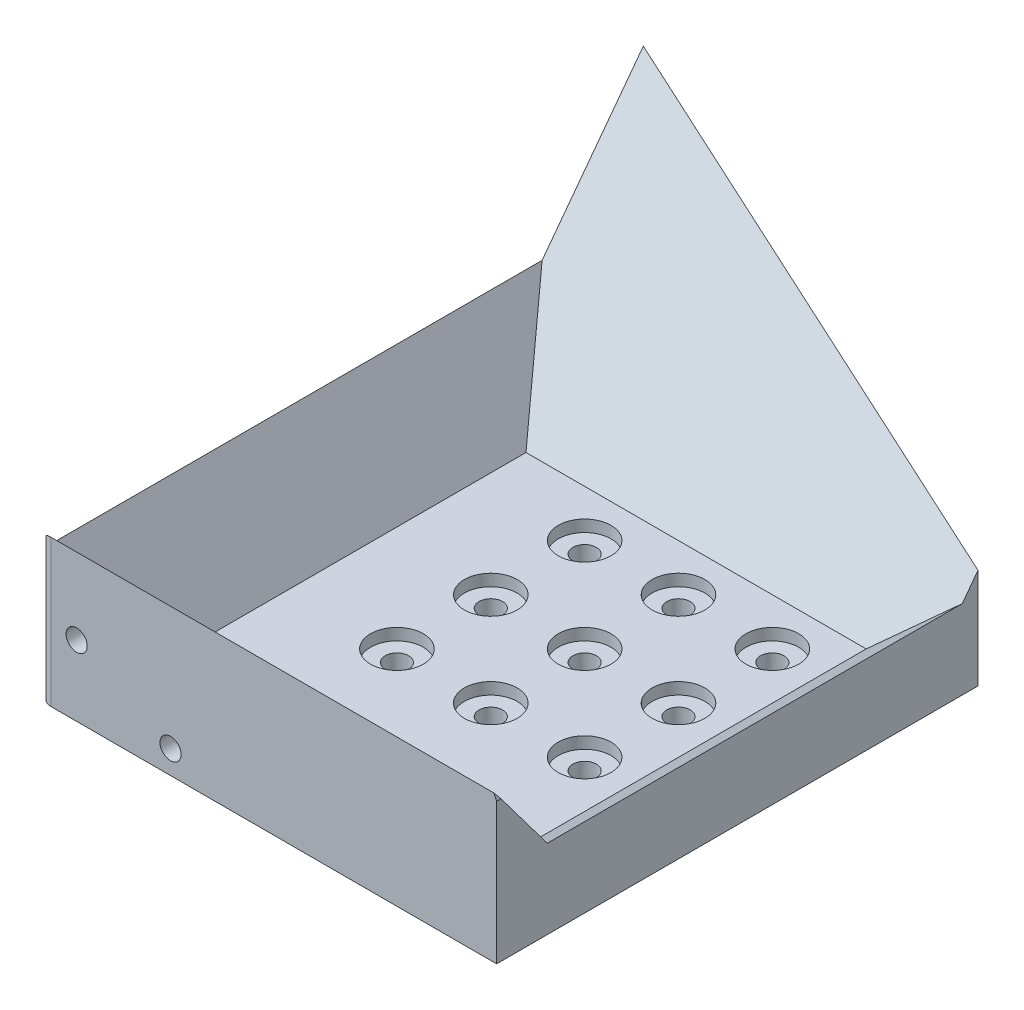
from build123d import *
from build123d.topology import SkipClean

# Parameters (mm, degrees)
SKETCH_1_W           = 62
SKETCH_1_H           = 62
EXTRUDE_1_DEPTH      = 19
SKETCH_4_W           = 58
SKETCH_4_H           = 58
CUT_EXTRUDE_1_DEPTH  = 17
SKETCH_5_W           = 8
SKETCH_5_H           = 62
EXTRUDE_2_DEPTH      = 19
SKETCH_7_W           = 58
SKETCH_7_H           = 17
CUT_EXTRUDE_2_DEPTH  = 19
CUT_EXTRUDE_3_DEPTH  = 108
SKETCH_9_W           = 70
SKETCH_9_H           = 2
EXTRUDE_3_DEPTH      = 28
SKETCH_10_W          = 70
SKETCH_10_H          = 28
EXTRUDE_4_DEPTH      = 40
CUT_EXTRUDE_5_DEPTH  = 90
SKETCH_14_W          = 60
SKETCH_14_H          = 62
CUT_EXTRUDE_6_DEPTH  = 17
SKETCH_15_W          = 62
SKETCH_15_H          = 2
EXTRUDE_6_DEPTH      = 8
SKETCH_18_W          = 10
SKETCH_18_H          = 62
EXTRUDE_8_DEPTH      = 19
CUT_EXTRUDE_7_DEPTH  = 62
EXTRUDE_9_DEPTH      = 8
SKETCH_23_W          = 78
SKETCH_23_H          = 2
EXTRUDE_13_DEPTH     = 28
SKETCH_25_W          = 78
SKETCH_25_H          = 28
EXTRUDE_14_DEPTH     = 40
CUT_EXTRUDE_8_DEPTH  = 99
EXTRUDE_19_DEPTH     = 78
EXTRUDE_20_DEPTH     = 78
EXTRUDE_21_DEPTH     = 24
EXTRUDE_22_DEPTH     = 24
EXTRUDE_23_DEPTH     = 24
EXTRUDE_24_DEPTH     = 24
SKETCH_43_W          = 78
SKETCH_43_H          = 118
EXTRUDE_25_DEPTH     = 1
CUT_EXTRUDE_14_DEPTH = 127
CUT_EXTRUDE_15_DEPTH = 80
SKETCH_49_R          = 2
CUT_EXTRUDE_17_DEPTH = 19
SKETCH_50_R          = 4.5
CUT_EXTRUDE_18_DEPTH = 2
SKETCH_55_R          = 2
CUT_EXTRUDE_20_DEPTH = 7.5
SKETCH_57_W          = 36.095465849
SKETCH_57_H          = 32.16378967
EXTRUDE_26_DEPTH     = 7
SKETCH_63_R          = 1.8
CUT_EXTRUDE_23_DEPTH = 7.5
SKETCH_64_W          = 78
SKETCH_64_H          = 118
EXTRUDE_27_DEPTH     = 1
SKETCH_65_R          = 2
CUT_EXTRUDE_24_DEPTH = 29
SKETCH_66_W          = 78
SKETCH_66_H          = 118
EXTRUDE_28_DEPTH     = 1
SKETCH_68_R          = 2
CUT_EXTRUDE_25_DEPTH = 28
SKETCH_69_W          = 78
SKETCH_69_H          = 52.036508638
CUT_EXTRUDE_26_DEPTH = 15
FILLET_1_R           = 2
CUT_EXTRUDE_27_DEPTH = 123.576506721
SKETCH_73_R          = 1.8
CUT_EXTRUDE_28_DEPTH = 8
SKETCH_74_R          = 1.8
CUT_EXTRUDE_29_DEPTH = 8


with BuildPart() as part:
    # 草圖1 → 填料-伸長1 (new body)
    with BuildSketch(Plane(origin=(0, 0, 0), x_dir=(1, 0, 0), z_dir=(0, 1, 0))):
        with Locations((31, 31)):
            Rectangle(SKETCH_1_W, SKETCH_1_H)
    extrude(amount=EXTRUDE_1_DEPTH)

    # 草圖4 → 除料-伸長1 (cut)
    with BuildSketch(Plane(origin=(0, 19, 0), x_dir=(1, 0, 0), z_dir=(0, 1, 0))):
        with Locations((31, 31)):
            Rectangle(SKETCH_4_W, SKETCH_4_H)
    extrude(amount=-CUT_EXTRUDE_1_DEPTH, mode=Mode.SUBTRACT)

    # 草圖5 → 填料-伸長2 (add)
    with BuildSketch(Plane(origin=(0, 19, 0), x_dir=(1, 0, 0), z_dir=(0, 1, 0))):
        with Locations((-4, 31)):
            Rectangle(SKETCH_5_W, SKETCH_5_H)
    extrude(amount=-EXTRUDE_2_DEPTH)

    # 草圖7 → 除料-伸長2 (cut)
    with BuildSketch(Plane.XY.offset(-60)):
        with Locations((31, 10.5)):
            Rectangle(SKETCH_7_W, SKETCH_7_H)
    extrude(amount=-CUT_EXTRUDE_2_DEPTH, mode=Mode.SUBTRACT)

    # 草圖8 → 除料-伸長3 (cut)
    with BuildSketch(Plane(origin=(0, 0, -62), x_dir=(-1, 0, 0), z_dir=(0, 0, -1))):
        Polygon((-2, 2), (8, 19), (-2, 19), align=None)
    extrude(amount=-CUT_EXTRUDE_3_DEPTH, mode=Mode.SUBTRACT)

    # 草圖9 → 填料-伸長3 (add)
    with BuildSketch(Plane(origin=(0, 0, -62), x_dir=(-1, 0, 0), z_dir=(0, 0, -1))):
        with Locations((-27, 1)):
            Rectangle(SKETCH_9_W, SKETCH_9_H)
    extrude(amount=EXTRUDE_3_DEPTH)

    # 草圖10 → 填料-伸長4 (add)
    with BuildSketch(Plane(origin=(0, 2, 0), x_dir=(1, 0, 0), z_dir=(0, 1, 0))):
        with Locations((27, 76)):
            Rectangle(SKETCH_10_W, SKETCH_10_H)
    extrude(amount=EXTRUDE_4_DEPTH)

    # 草圖11 → 除料-伸長5 (cut)
    with BuildSketch(Plane.ZY.offset(8)):
        Polygon((-62, 42), (-62, 2), (-90, 42), align=None)
    extrude(amount=-CUT_EXTRUDE_5_DEPTH, mode=Mode.SUBTRACT)

    # 草圖14 → 除料-伸長6 (cut)
    with BuildSketch(Plane(origin=(0, 19, 0), x_dir=(1, 0, 0), z_dir=(0, 1, 0))):
        with Locations((32, 31)):
            Rectangle(SKETCH_14_W, SKETCH_14_H)
    extrude(amount=-CUT_EXTRUDE_6_DEPTH, mode=Mode.SUBTRACT)

    # 草圖15 → 填料-伸長6 (add)
    with BuildSketch(Plane(origin=(62, 0, 0), x_dir=(0, 0, -1), z_dir=(1, 0, 0))):
        with Locations((31, 1)):
            Rectangle(SKETCH_15_W, SKETCH_15_H)
    extrude(amount=EXTRUDE_6_DEPTH)

    # 草圖18 → 填料-伸長8 (add)
    with BuildSketch(Plane(origin=(0, 2, 0), x_dir=(1, 0, 0), z_dir=(0, 1, 0))):
        with Locations((65, 31)):
            Rectangle(SKETCH_18_W, SKETCH_18_H)
    extrude(amount=EXTRUDE_8_DEPTH)

    # 草圖19 → 除料-伸長7 (cut)
    with BuildSketch(Plane.XY):
        Polygon((60, 2), (70, 10.5), (70, 21), (60, 21), align=None)
    extrude(amount=-CUT_EXTRUDE_7_DEPTH, mode=Mode.SUBTRACT)

    # 草圖20 → 填料-伸長9 (add)
    with BuildSketch(Plane(origin=(62, 0, 0), x_dir=(0, 0, -1), z_dir=(1, 0, 0))):
        Polygon((90, 42), (62, 2), (62, 0), (90, 0), align=None)
    extrude(amount=EXTRUDE_9_DEPTH)

    # 草圖23 → 填料-伸長13 (add)
    with BuildSketch(Plane.XY):
        with Locations((31, 1)):
            Rectangle(SKETCH_23_W, SKETCH_23_H)
    extrude(amount=EXTRUDE_13_DEPTH)

    # 草圖25 → 填料-伸長14 (add)
    with BuildSketch(Plane(origin=(0, 2, 0), x_dir=(1, 0, 0), z_dir=(0, 1, 0))):
        with Locations((31, -14)):
            Rectangle(SKETCH_25_W, SKETCH_25_H)
    extrude(amount=EXTRUDE_14_DEPTH)

    # 草圖26 → 除料-伸長8 (cut)
    with BuildSketch(Plane.ZY.offset(8)):
        Polygon((28, 42), (0, 42), (0, 2), align=None)
    extrude(amount=-CUT_EXTRUDE_8_DEPTH, mode=Mode.SUBTRACT)

    # 草圖34 → 填料-伸長19 (add)
    with BuildSketch(Plane(origin=(70, 0, 0), x_dir=(0, 0, -1), z_dir=(1, 0, 0))):
        Polygon((-28, 2), (0, 2), (-28, 42), align=None)
        Polygon((-28, 42), (0, 2), (0, 4.666666667), align=None)
        Polygon((0, 4.666666667), (0, 2), (2, 2), align=None)
    extrude(amount=-EXTRUDE_19_DEPTH)

    # 草圖36 → 填料-伸長20 (add)
    with BuildSketch(Plane.ZY.offset(8)):
        Polygon((-90, 2), (-62, 2), (-90, 42), align=None)
        Polygon((-90, 42), (-62, 2), (-62, 4.666666667), align=None)
        Polygon((-62, 4.666666667), (-62, 2), (-60, 2), align=None)
    extrude(amount=-EXTRUDE_20_DEPTH)

    # 草圖37 → 填料-伸長21 (add)
    with BuildSketch(Plane(origin=(0, 0, -62), x_dir=(-1, 0, 0), z_dir=(0, 0, -1))):
        Polygon((8, 4.666666667), (-0.431372549, 4.666666667), (8, 19), align=None)
    extrude(amount=EXTRUDE_21_DEPTH)

    # 草圖38 → 填料-伸長22 (add)
    with BuildSketch(Plane(origin=(0, 0, -62), x_dir=(-1, 0, 0), z_dir=(0, 0, -1))):
        Polygon((-63.137254902, 4.666666667), (-70, 4.666666667), (-70, 10.5), align=None)
    extrude(amount=EXTRUDE_22_DEPTH)

    # 草圖39 → 填料-伸長23 (add)
    with BuildSketch(Plane.XY):
        Polygon((-8, 19), (-8, 4.666666667), (0.431372549, 4.666666667), align=None)
    extrude(amount=EXTRUDE_23_DEPTH)

    # 草圖40 → 填料-伸長24 (add)
    with BuildSketch(Plane.XY):
        Polygon((70, 10.5), (63.137254902, 4.666666667), (70, 4.666666667), align=None)
    extrude(amount=EXTRUDE_24_DEPTH)

    # 草圖43 → 填料-伸長25 (add)
    with BuildSketch(Plane(origin=(0, 0, 0), x_dir=(-1, 0, 0), z_dir=(0, -1, 0))):
        with Locations((-31, 31)):
            Rectangle(SKETCH_43_W, SKETCH_43_H)
    extrude(amount=EXTRUDE_25_DEPTH)

    # 草圖46 → 除料-伸長14 (cut)
    with BuildSketch(Plane(origin=(0, 0, -90), x_dir=(-1, 0, 0), z_dir=(0, 0, -1))):
        Polygon((-70, 42), (-60, 42), (-70, 21), align=None)
    extrude(amount=-CUT_EXTRUDE_14_DEPTH, mode=Mode.SUBTRACT)

    # 草圖47 → 除料-伸長15 (cut)
    with BuildSketch(Plane.XY.offset(28)):
        Polygon((-8, 42), (2, 42), (-8, 21), align=None)
    extrude(amount=-CUT_EXTRUDE_15_DEPTH, mode=Mode.SUBTRACT)

    # 草圖49 → 除料-伸長17 (cut)
    with BuildSketch(Plane(origin=(0, 2, 0), x_dir=(1, 0, 0), z_dir=(0, 1, 0))):
        with Locations(Location((52, 52, 0), (0, 0, 270))):
            Circle(SKETCH_49_R)
        with Locations(Location((36, 52, 0), (0, 0, 270))):
            Circle(SKETCH_49_R)
        with Locations(Location((20, 52, 0), (0, 0, 270))):
            Circle(SKETCH_49_R)
        with Locations(Location((36, 36, 0), (0, 0, 270))):
            Circle(SKETCH_49_R)
        with Locations(Location((20, 36, 0), (0, 0, 270))):
            Circle(SKETCH_49_R)
        with Locations(Location((36, 20, 0), (0, 0, 270))):
            Circle(SKETCH_49_R)
        with Locations(Location((20, 20, 0), (0, 0, 270))):
            Circle(SKETCH_49_R)
        with Locations(Location((52, 36, 0), (0, 0, 270))):
            Circle(SKETCH_49_R)
        with Locations(Location((52, 20, 0), (0, 0, 270))):
            Circle(SKETCH_49_R)
    extrude(amount=-CUT_EXTRUDE_17_DEPTH, mode=Mode.SUBTRACT)

    # 草圖50 → 除料-伸長18 (cut)
    with BuildSketch(Plane(origin=(0, 2, 0), x_dir=(1, 0, 0), z_dir=(0, 1, 0))):
        with Locations(Location((52, 20, 0), (0, 0, 270))):
            Circle(SKETCH_50_R)
        with Locations(Location((36, 20, 0), (0, 0, 270))):
            Circle(SKETCH_50_R)
        with Locations(Location((20, 20, 0), (0, 0, 270))):
            Circle(SKETCH_50_R)
        with Locations(Location((36, 36, 0), (0, 0, 270))):
            Circle(SKETCH_50_R)
        with Locations(Location((20, 36, 0), (0, 0, 270))):
            Circle(SKETCH_50_R)
        with Locations(Location((36, 52, 0), (0, 0, 270))):
            Circle(SKETCH_50_R)
        with Locations(Location((20, 52, 0), (0, 0, 270))):
            Circle(SKETCH_50_R)
        with Locations(Location((52, 36, 0), (0, 0, 270))):
            Circle(SKETCH_50_R)
        with Locations(Location((52, 52, 0), (0, 0, 270))):
            Circle(SKETCH_50_R)
    extrude(amount=-CUT_EXTRUDE_18_DEPTH, mode=Mode.SUBTRACT)

    # 草圖55 → 除料-伸長20 (cut)
    with BuildSketch(Plane(origin=(0, 0, -90), x_dir=(-1, 0, 0), z_dir=(0, 0, -1))):
        with Locations((-5, 7)):
            Circle(SKETCH_55_R)
        with Locations((-13, 7)):
            Circle(SKETCH_55_R)
        with Locations((-5, 15)):
            Circle(SKETCH_55_R)
        with Locations((-13, 15)):
            Circle(SKETCH_55_R)
        with Locations((-5, 23)):
            Circle(SKETCH_55_R)
        with Locations((-13, 23)):
            Circle(SKETCH_55_R)
        with Locations((3, 15)):
            Circle(SKETCH_55_R)
        with Locations((3, 23)):
            Circle(SKETCH_55_R)
    extrude(amount=-CUT_EXTRUDE_20_DEPTH, mode=Mode.SUBTRACT)

    # 草圖57 → 填料-伸長26 (add)
    with SkipClean():  # the faces are left unmerged after this step: merging them gives an invalid solid
        with BuildSketch(Plane(origin=(0, 0, -90), x_dir=(-1, 0, 0), z_dir=(0, 0, -1))):
            with Locations((-10.047732924, 15.081894835)):
                Rectangle(SKETCH_57_W, SKETCH_57_H)
        extrude(amount=-EXTRUDE_26_DEPTH)

    # 草圖63 → 除料-伸長23 (cut)
    with SkipClean():  # the faces are left unmerged after this step: merging them gives an invalid solid
        with BuildSketch(Plane(origin=(0, 0, -90), x_dir=(-1, 0, 0), z_dir=(0, 0, -1))):
            with Locations((-64, 7)):
                Circle(SKETCH_63_R)
            with Locations((-56, 7)):
                Circle(SKETCH_63_R)
            with Locations((-48, 7)):
                Circle(SKETCH_63_R)
            with Locations((-56, 15)):
                Circle(SKETCH_63_R)
            with Locations((-48, 15)):
                Circle(SKETCH_63_R)
            with Locations((-56, 23)):
                Circle(SKETCH_63_R)
            with Locations((-48, 23)):
                Circle(SKETCH_63_R)
            with Locations((-64, 15)):
                Circle(SKETCH_63_R)
            with Locations((-64, 23)):
                Circle(SKETCH_63_R)
        extrude(amount=-CUT_EXTRUDE_23_DEPTH, mode=Mode.SUBTRACT)

    # 草圖64 → 填料-伸長27 (add)
    with SkipClean():  # the faces are left unmerged after this step: merging them gives an invalid solid
        with BuildSketch(Plane(origin=(0, -1, 0), x_dir=(-1, 0, 0), z_dir=(0, -1, 0))):
            with Locations((-31, 31)):
                Rectangle(SKETCH_64_W, SKETCH_64_H)
        extrude(amount=EXTRUDE_27_DEPTH)

    # 草圖65 → 除料-伸長24 (cut)
    with SkipClean():  # the faces are left unmerged after this step: merging them gives an invalid solid
        with BuildSketch(Plane(origin=(0, -1, 0), x_dir=(1, 0, 0), z_dir=(0, 1, 0))):
            with Locations(Location((52, 52, 0), (0, 0, 270))):
                Circle(SKETCH_65_R)
            with Locations(Location((36, 52, 0), (0, 0, 270))):
                Circle(SKETCH_65_R)
            with Locations(Location((20, 52, 0), (0, 0, 270))):
                Circle(SKETCH_65_R)
            with Locations(Location((36, 36, 0), (0, 0, 270))):
                Circle(SKETCH_65_R)
            with Locations(Location((20, 36, 0), (0, 0, 270))):
                Circle(SKETCH_65_R)
            with Locations(Location((36, 20, 0), (0, 0, 270))):
                Circle(SKETCH_65_R)
            with Locations(Location((20, 20, 0), (0, 0, 270))):
                Circle(SKETCH_65_R)
            with Locations(Location((52, 36, 0), (0, 0, 270))):
                Circle(SKETCH_65_R)
            with Locations(Location((52, 20, 0), (0, 0, 270))):
                Circle(SKETCH_65_R)
        extrude(amount=-CUT_EXTRUDE_24_DEPTH, mode=Mode.SUBTRACT)

    # 草圖66 → 填料-伸長28 (add)
    with SkipClean():  # the faces are left unmerged after this step: merging them gives an invalid solid
        with BuildSketch(Plane(origin=(0, -2, 0), x_dir=(-1, 0, 0), z_dir=(0, -1, 0))):
            with Locations((-31, 31)):
                Rectangle(SKETCH_66_W, SKETCH_66_H)
        extrude(amount=EXTRUDE_28_DEPTH)

    # 草圖68 → 除料-伸長25 (cut)
    with SkipClean():  # the faces are left unmerged after this step: merging them gives an invalid solid
        with BuildSketch(Plane(origin=(0, -2, 0), x_dir=(1, 0, 0), z_dir=(0, 1, 0))):
            with Locations(Location((20, 20, 0), (0, 0, 270))):
                Circle(SKETCH_68_R)
            with Locations(Location((36, 20, 0), (0, 0, 270))):
                Circle(SKETCH_68_R)
            with Locations(Location((52, 20, 0), (0, 0, 270))):
                Circle(SKETCH_68_R)
            with Locations(Location((36, 36, 0), (0, 0, 270))):
                Circle(SKETCH_68_R)
            with Locations(Location((52, 36, 0), (0, 0, 270))):
                Circle(SKETCH_68_R)
            with Locations(Location((36, 52, 0), (0, 0, 270))):
                Circle(SKETCH_68_R)
            with Locations(Location((52, 52, 0), (0, 0, 270))):
                Circle(SKETCH_68_R)
            with Locations(Location((20, 36, 0), (0, 0, 270))):
                Circle(SKETCH_68_R)
            with Locations(Location((20, 52, 0), (0, 0, 270))):
                Circle(SKETCH_68_R)
        extrude(amount=-CUT_EXTRUDE_25_DEPTH, mode=Mode.SUBTRACT)

    # 草圖69 → 除料-伸長26 (cut)
    with SkipClean():  # the faces are left unmerged after this step: merging them gives an invalid solid
        with BuildSketch(Plane.XY.offset(28)):
            with Locations((31, 23.018254319)):
                Rectangle(SKETCH_69_W, SKETCH_69_H)
        extrude(amount=-CUT_EXTRUDE_26_DEPTH, mode=Mode.SUBTRACT)

    # 圓角1
    fillet_1_edges = [part.edges().sort_by_distance(p)[0] for p in [
        (-8, 10, 13),
    ]]
    fillet(fillet_1_edges, radius=FILLET_1_R)

    # 草圖71 → 除料-伸長27 (cut, through all)
    with SkipClean():  # the faces are left unmerged after this step: merging them gives an invalid solid
        with BuildSketch(Plane.XZ.offset(3)):
            Polygon((-8, -90), (70, -69.061929779), (70, -90), align=None)
        extrude(amount=-CUT_EXTRUDE_27_DEPTH, mode=Mode.SUBTRACT)

    # 草圖73 → 除料-伸長28 (cut)
    with SkipClean():  # the faces are left unmerged after this step: merging them gives an invalid solid
        with BuildSketch(Plane.ZY.offset(8)):
            with Locations((-9.4, 1)):
                Circle(SKETCH_73_R)
            with Locations((-1.4, 1)):
                Circle(SKETCH_73_R)
        extrude(amount=-CUT_EXTRUDE_28_DEPTH, mode=Mode.SUBTRACT)

    # 草圖74 → 除料-伸長29 (cut)
    with SkipClean():  # the faces are left unmerged after this step: merging them gives an invalid solid
        with BuildSketch(Plane.XY.offset(13)):
            with Locations((-1.6, 9)):
                Circle(SKETCH_74_R)
            with Locations((14.4, 1)):
                Circle(SKETCH_74_R)
        extrude(amount=-CUT_EXTRUDE_29_DEPTH, mode=Mode.SUBTRACT)


solid = part.part
